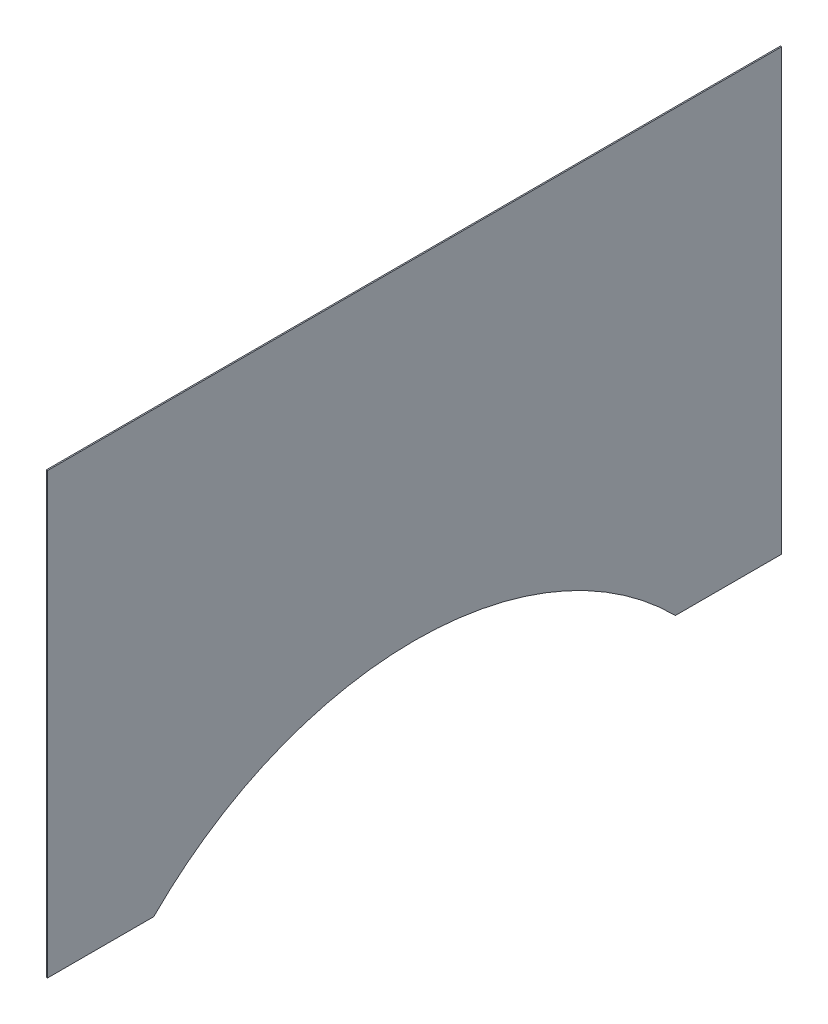
from build123d import *

# Parameters (mm, degrees)
BOSS_EXTRUDE1_DEPTH = 0.79375


with BuildPart() as part:
    # Sketch1 → Boss-Extrude1 (new body)
    with BuildSketch(Plane(origin=(0, 0, 0), x_dir=(0, 0, -1), z_dir=(1, 0, 0))):
        with BuildLine():
            Line((-241.3, 217.420722855), (241.3, 217.420722855))
            Line((241.3, 217.420722855), (241.3, -71.504277145))
            Line((241.3, -71.504277145), (171.45, -71.504277145))
            ThreePointArc((171.45, -71.504277145), (0, 0), (-171.45, -71.504277145))
            Line((-171.45, -71.504277145), (-241.3, -71.504277145))
            Line((-241.3, -71.504277145), (-241.3, 217.420722855))
        make_face()
    extrude(amount=BOSS_EXTRUDE1_DEPTH)


solid = part.part
